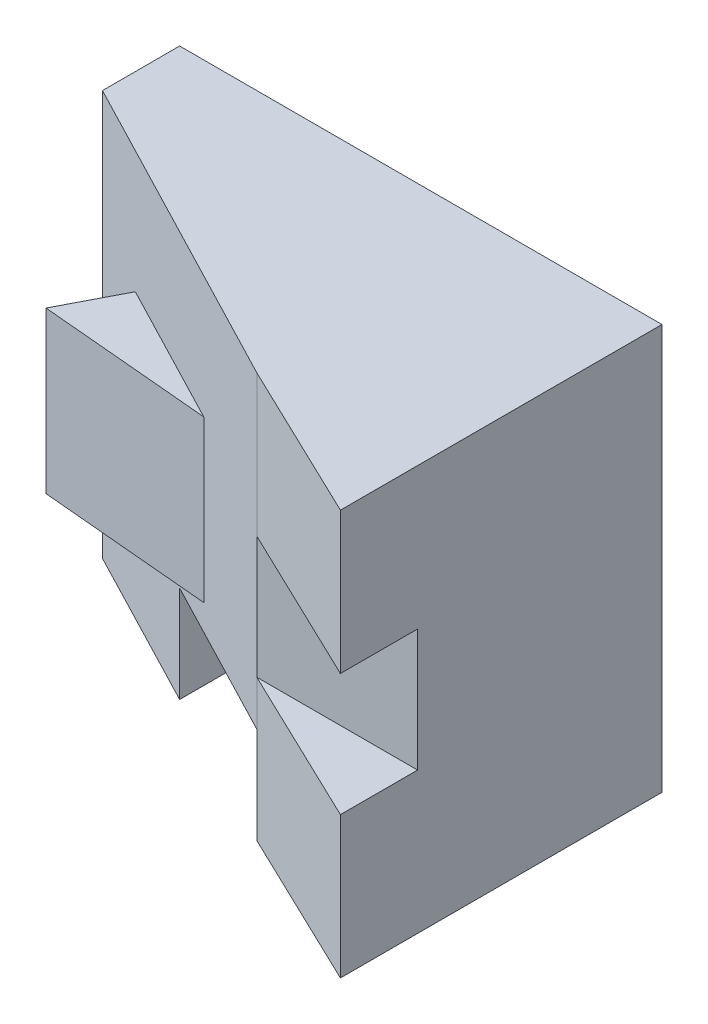
from build123d import *

# Parameters (mm, degrees)
SKETCH1_W           = 75
SKETCH1_H           = 63
BOSS_EXTRUDE1_DEPTH = 12
SKETCH2_W           = 25
SKETCH2_H           = 25
BOSS_EXTRUDE2_DEPTH = 63
CUT_EXTRUDE1_DEPTH  = 114
BOSS_EXTRUDE3_DEPTH = 63
SKETCH6_W           = 25
SKETCH6_H           = 12
CUT_EXTRUDE2_DEPTH  = 15
BOSS_EXTRUDE5_DEPTH = 48
SKETCH8_W           = 12
SKETCH8_H           = 19
CUT_EXTRUDE3_DEPTH  = 25
SKETCH9_W           = 25
SKETCH9_H           = 25
BOSS_EXTRUDE7_DEPTH = 44
CUT_EXTRUDE7_DEPTH  = 44
CUT_EXTRUDE8_DEPTH  = 44


with BuildPart() as part:
    # Sketch1 → Boss-Extrude1 (new body)
    with BuildSketch(Plane.XY):
        with Locations((37.5, -31.5)):
            Rectangle(SKETCH1_W, SKETCH1_H)
    extrude(amount=BOSS_EXTRUDE1_DEPTH)

    # Sketch2 → Boss-Extrude2 (add)
    with BuildSketch(Plane(origin=(0, -63, 0), x_dir=(-1, 0, 0), z_dir=(0, -1, 0))):
        with Locations((-12.5, -12.5)):
            Rectangle(SKETCH2_W, SKETCH2_H)
    extrude(amount=-BOSS_EXTRUDE2_DEPTH)

    # Sketch3 → Cut-Extrude1 (cut)
    with BuildSketch(Plane(origin=(0, -63, 0), x_dir=(-1, 0, 0), z_dir=(0, -1, 0))):
        Polygon((-25, -25), (0, -12), (0, -25), align=None)
    extrude(amount=-CUT_EXTRUDE1_DEPTH, mode=Mode.SUBTRACT)

    # Sketch4 → Boss-Extrude3 (add)
    with BuildSketch(Plane.XZ.offset(63)):
        Polygon((75, 50), (50, 38), (50, 0), (75, 0), align=None)
    extrude(amount=-BOSS_EXTRUDE3_DEPTH)

    # Sketch6 → Cut-Extrude2 (cut)
    with BuildSketch(Plane.XZ.offset(63)):
        with Locations((37.5, 6)):
            Rectangle(SKETCH6_W, SKETCH6_H)
    extrude(amount=-CUT_EXTRUDE2_DEPTH, mode=Mode.SUBTRACT)

    # Sketch7 → Boss-Extrude5 (add)
    with BuildSketch(Plane.XZ.offset(48)):
        Polygon((50, 38), (50, 12), (25, 12), (25, 25), align=None)
    extrude(amount=-BOSS_EXTRUDE5_DEPTH)

    # Sketch8 → Cut-Extrude3 (cut)
    with BuildSketch(Plane(origin=(75, 0, 0), x_dir=(0, 0, -1), z_dir=(1, 0, 0))):
        with Locations((-44, -31.5)):
            Rectangle(SKETCH8_W, SKETCH8_H)
    extrude(amount=-CUT_EXTRUDE3_DEPTH, mode=Mode.SUBTRACT)

    # Sketch9 → Boss-Extrude7 (add)
    with BuildSketch(Plane(origin=(-4.911838791, 0, 9.445843829), x_dir=(0.887216801234595, 0, 0.4613527366419899), z_dir=(-0.4613527366419899, 0, 0.887216801234595))):
        with Locations((30.03623284, -31.5)):
            Rectangle(SKETCH9_W, SKETCH9_H)
    extrude(amount=BOSS_EXTRUDE7_DEPTH)

    # Sketch12 → Cut-Extrude7 (cut)
    with BuildSketch(Plane(origin=(0, -44, 0), x_dir=(-1, 0, 0), z_dir=(0, -1, 0))):
        Polygon((-3.264957829, -31.731701659), (9.652918797, -56.573772094), (-12.527501233, -68.10759051), (-32.827021646, -29.070051256), align=None)
    extrude(amount=-CUT_EXTRUDE7_DEPTH, mode=Mode.SUBTRACT)

    # Sketch13 → Cut-Extrude8 (cut)
    with BuildSketch(Plane.XZ.offset(44)):
        Polygon((32.827021646, 29.070051256), (5.896218628, 26.671584738), (3.264957829, 31.731701659), align=None)
    extrude(amount=-CUT_EXTRUDE8_DEPTH, mode=Mode.SUBTRACT)


solid = part.part
